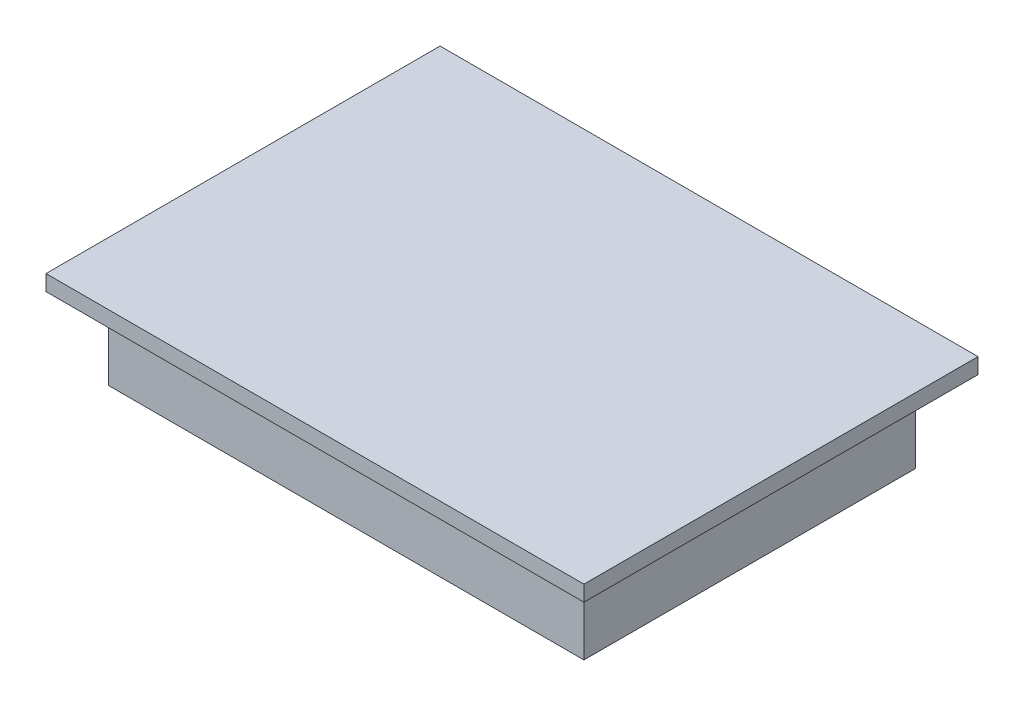
from build123d import *

# Parameters (mm, degrees)
SKETCH_1_W      = 76
SKETCH_1_H      = 53
EXTRUDE_1_DEPTH = 13
SKETCH_2_W      = 86
SKETCH_2_H      = 63
EXTRUDE_2_DEPTH = 2.5


with BuildPart() as part:
    # 草图1 → 凸台-拉伸1 (new body)
    with BuildSketch(Plane(origin=(0, 0, 0), x_dir=(1, 0, 0), z_dir=(0, 1, 0))):
        Rectangle(SKETCH_1_W, SKETCH_1_H)
    extrude(amount=EXTRUDE_1_DEPTH)

    # 草图2 → 凸台-拉伸2 (add)
    with BuildSketch(Plane(origin=(0, 13, 0), x_dir=(1, 0, 0), z_dir=(0, 1, 0))):
        Rectangle(SKETCH_2_W, SKETCH_2_H)
    extrude(amount=EXTRUDE_2_DEPTH)


solid = part.part
